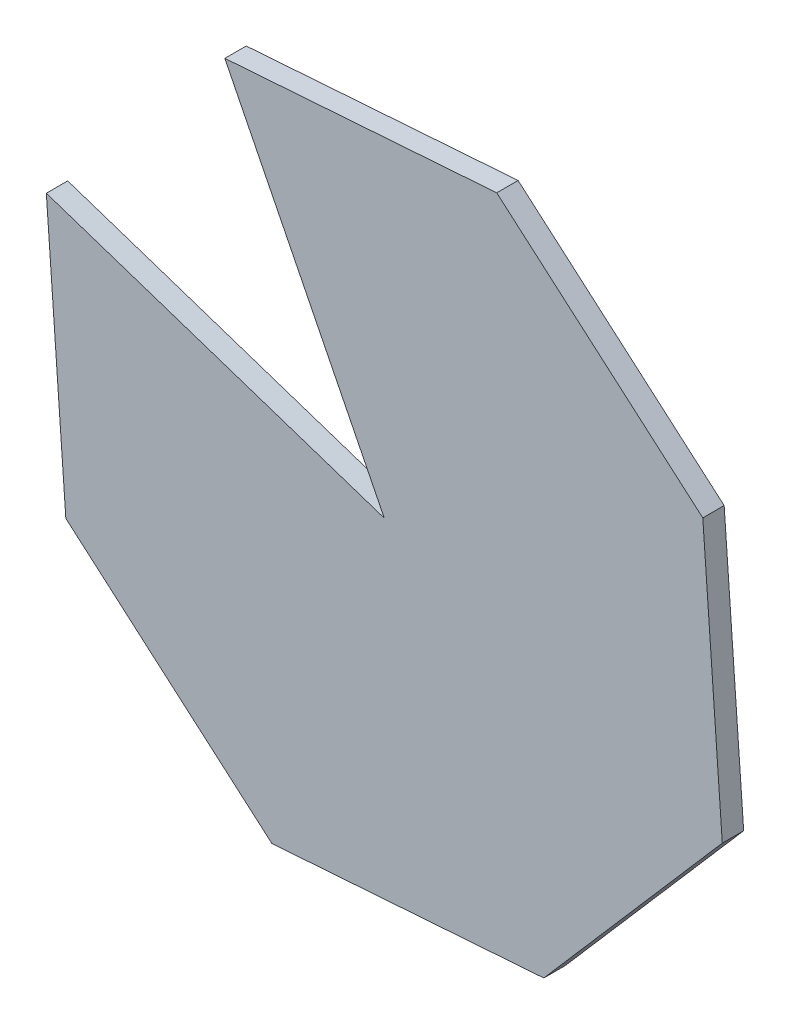
from build123d import *

# Parameters (mm, degrees)
BOSS_EXTRUDE2_DEPTH = 3


with BuildPart() as part:
    # Sketch1 → Boss-Extrude2 (new body)
    with BuildSketch(Plane.XY):
        Polygon((0, 0), (-22.388573959, 44.707401581), (15.78179436, 47.444019294), (44.707401581, 22.388573959), (47.444019294, -15.78179436), (22.388573959, -44.707401581), (-15.78179436, -47.444019294), (-44.707401581, -22.388573959), (-47.444019294, 15.78179436), align=None)
    extrude(amount=BOSS_EXTRUDE2_DEPTH)


solid = part.part
